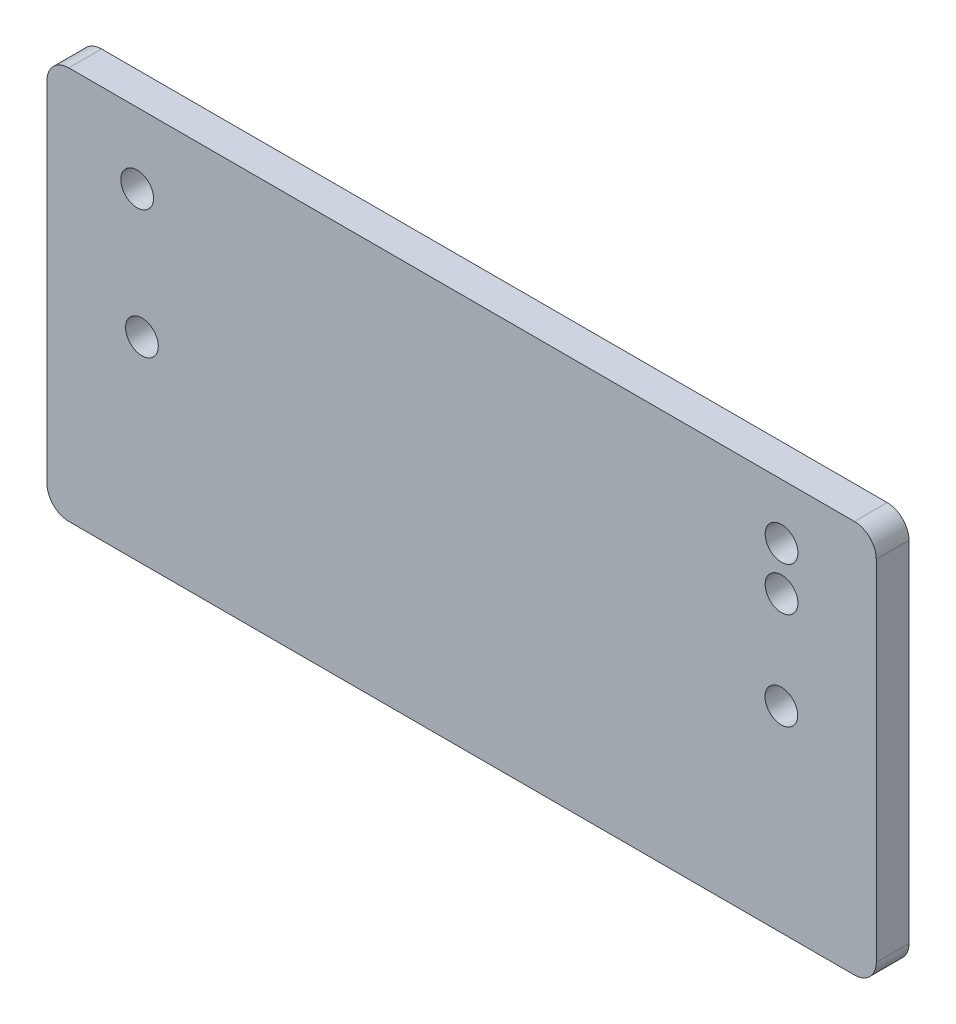
from build123d import *

# Parameters (mm, degrees)
EXTRUDE_1_DEPTH     = 3
SKETCH_2_R          = 1.5
CUT_EXTRUDE_1_DEPTH = 3


with BuildPart() as part:
    # 草图1 → 凸台-拉伸1 (new body)
    with BuildSketch(Plane.XY):
        with BuildLine():
            Line((-31.324082862, 0), (40.675917138, 0))
            ThreePointArc((40.675917138, 0), (42.090130701, -0.585786438), (42.675917138, -2))
            Line((42.675917138, -2), (42.675917138, -34))
            ThreePointArc((42.675917138, -34), (42.090130701, -35.414213562), (40.675917138, -36))
            Line((40.675917138, -36), (-31.324082862, -36))
            ThreePointArc((-31.324082862, -36), (-32.738296424, -35.414213562), (-33.324082862, -34))
            Line((-33.324082862, -34), (-33.324082862, -2))
            ThreePointArc((-33.324082862, -2), (-32.738296424, -0.585786438), (-31.324082862, 0))
        make_face()
    extrude(amount=EXTRUDE_1_DEPTH)

    # 草图2 → 切除-拉伸1 (cut)
    with BuildSketch(Plane.XY.offset(3)):
        with Locations((-24.624082862, -18)):
            Circle(SKETCH_2_R)
        with Locations((33.975917138, -18)):
            Circle(SKETCH_2_R)
        with Locations((-25.062556893, -6.477)):
            Circle(SKETCH_2_R)
        with Locations((33.992443107, -5.08)):
            Circle(SKETCH_2_R)
        with Locations((33.992443107, -9.08)):
            Circle(SKETCH_2_R)
    extrude(amount=-CUT_EXTRUDE_1_DEPTH, mode=Mode.SUBTRACT)


solid = part.part
